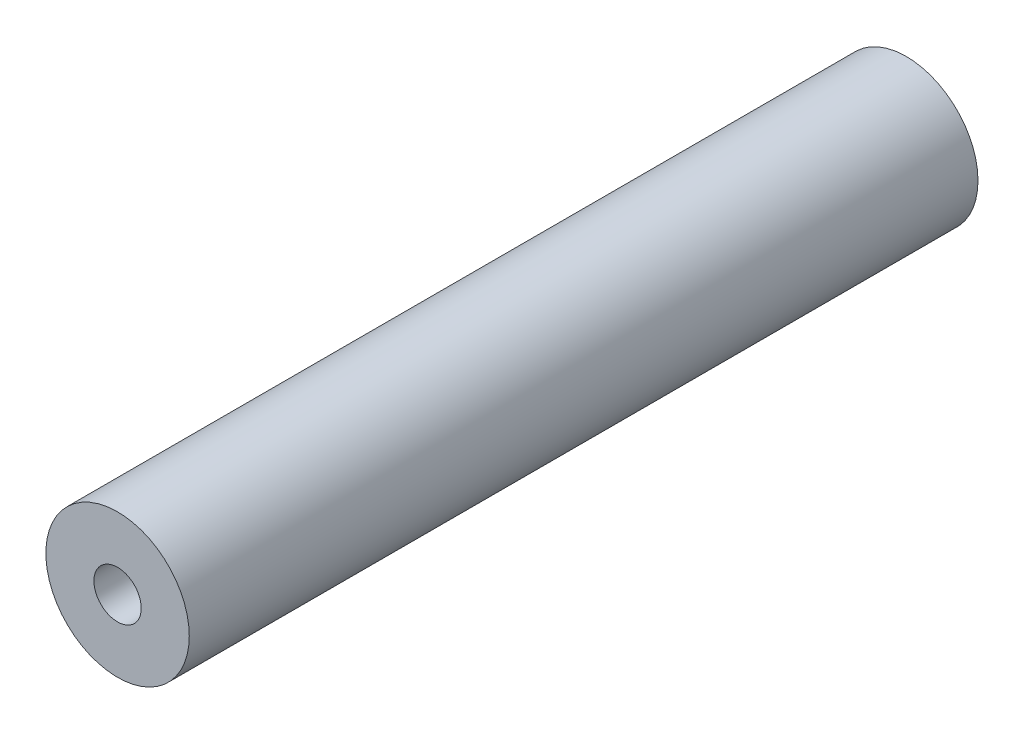
from build123d import *

# Parameters (mm, degrees)
SKETCH_1_R          = 5
EXTRUDE_1_DEPTH     = 55
SKETCH_2_R          = 1.65
CUT_EXTRUDE_1_DEPTH = 10
CUT_EXTRUDE_START   = -10
SKETCH_3_R          = 1.65
CUT_EXTRUDE_2_DEPTH = 10


with BuildPart() as part:
    # ｽｹｯﾁ1 → ﾎﾞｽ - 押し出し1 (new body)
    with BuildSketch(Plane.XY):
        Circle(SKETCH_1_R)
    extrude(amount=EXTRUDE_1_DEPTH)

    # ｽｹｯﾁ2 → ｶｯﾄ - 押し出し1 (cut)
    with BuildSketch(Plane.XY.offset(55)):
        Circle(SKETCH_2_R)
    extrude(amount=-CUT_EXTRUDE_1_DEPTH, mode=Mode.SUBTRACT)

    # ｽｹｯﾁ3 → ｶｯﾄ - 押し出し2 (cut)
    with BuildSketch(Plane(origin=(0, 0, 0), x_dir=(-1, 0, 0), z_dir=(0, 0, -1)).offset(CUT_EXTRUDE_START)):
        with Locations(Location((0, 0, 0), (0, 0, 180))):
            Circle(SKETCH_3_R)
    extrude(amount=CUT_EXTRUDE_2_DEPTH, mode=Mode.SUBTRACT)


solid = part.part
